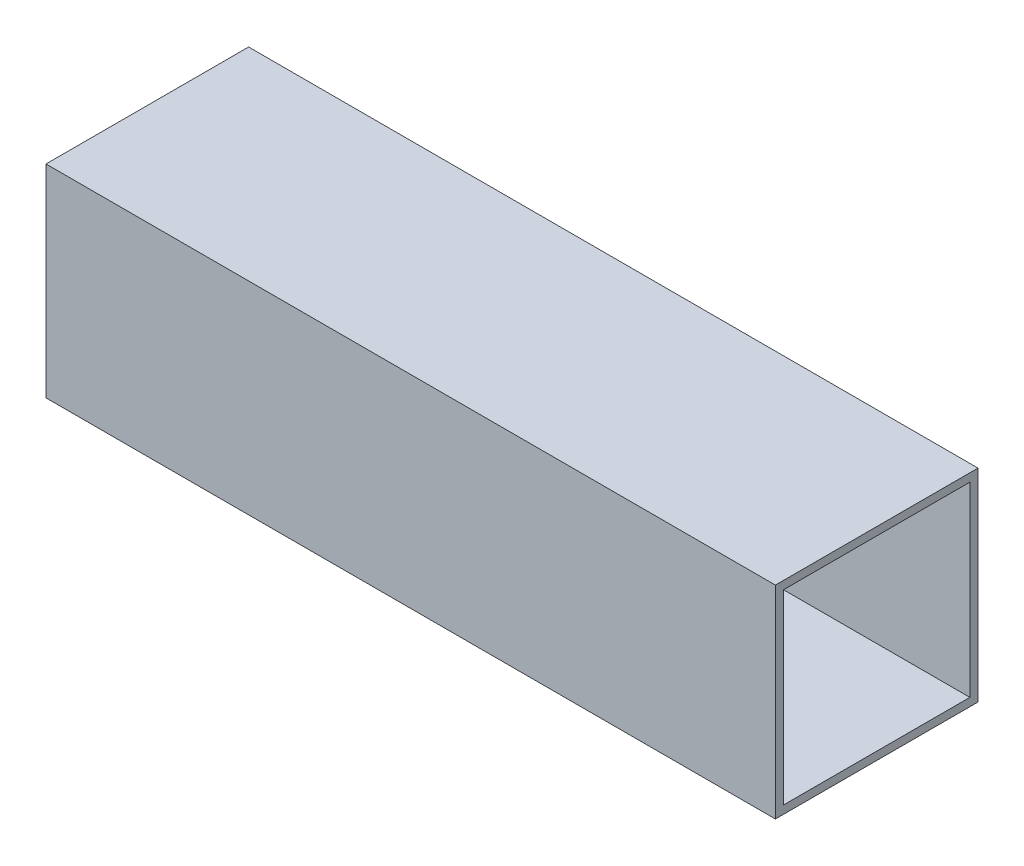
from build123d import *

# Parameters (mm, degrees)
SKETCH2_W           = 90
SKETCH2_H           = 25
BOSS_EXTRUDE1_DEPTH = 25
SKETCH3_W           = 23
SKETCH3_H           = 23
CUT_EXTRUDE1_DEPTH  = 97.695398029


with BuildPart() as part:
    # Sketch2 → Boss-Extrude1 (new body)
    with BuildSketch(Plane.XY):
        with Locations((45, -12.5)):
            Rectangle(SKETCH2_W, SKETCH2_H)
    extrude(amount=BOSS_EXTRUDE1_DEPTH)

    # Sketch3 → Cut-Extrude1 (cut, through all)
    with BuildSketch(Plane(origin=(90, 0, 0), x_dir=(0, 0, -1), z_dir=(1, 0, 0))):
        with Locations((-12.5, -12.5)):
            Rectangle(SKETCH3_W, SKETCH3_H)
    extrude(amount=-CUT_EXTRUDE1_DEPTH, mode=Mode.SUBTRACT)


solid = part.part
